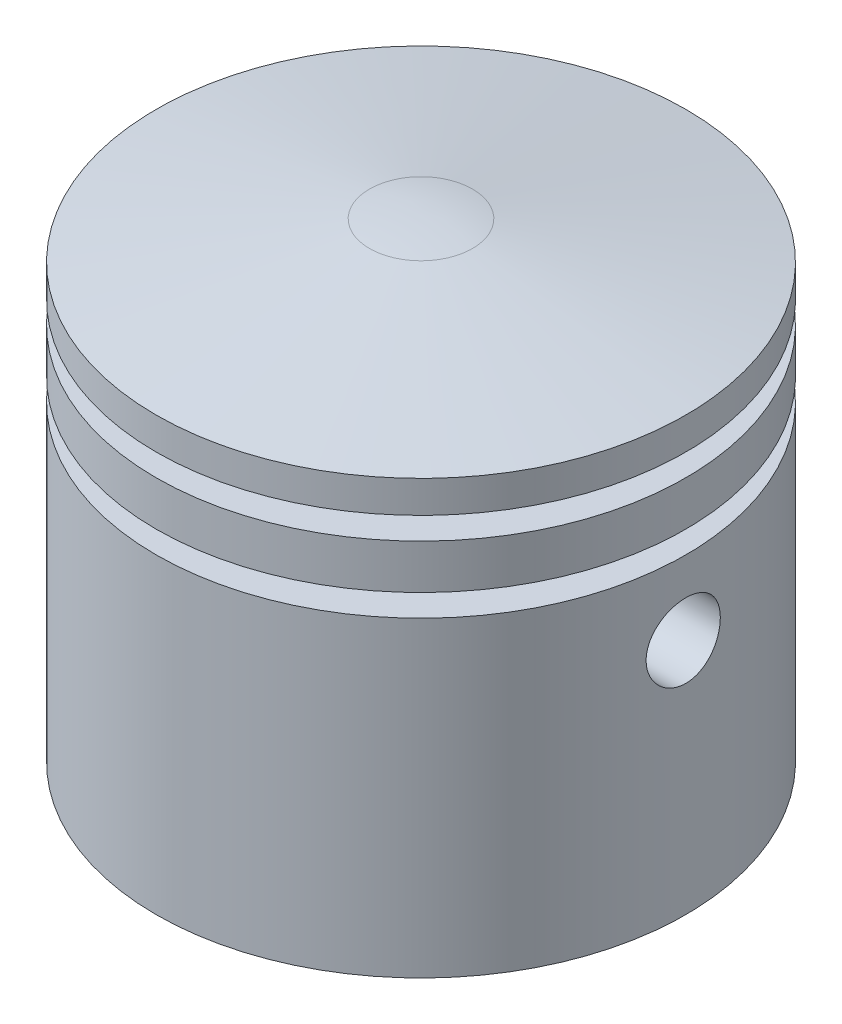
from build123d import *

# Parameters (mm, degrees)
CUT_EXTRUDE1_DEPTH      = 32.654993342
CUT_EXTRUDE1_DEPTH_BACK = 32.654993342
SKETCH3_R               = 2.5


with BuildPart() as part:
    # Sketch2 → Revolve1 (revolve)
    with BuildSketch(Plane.XY, mode=Mode.PRIVATE) as revolve1_sk:
        with BuildLine():
            Line((-17.847985654, 8.103335303), (-17.847985654, -12.896664697))
            Line((-17.847985654, -12.896664697), (-13, -12.896664697))
            Line((-13, -12.896664697), (-13, -2.896664697))
            Line((-13, -2.896664697), (-10, -2.896664697))
            Line((-10, -2.896664697), (-10, 11.103335303))
            Line((-10, 11.103335303), (0, 11.103335303))
            Line((0, 11.103335303), (0, 19.103335303))
            ThreePointArc((0, 19.103335303), (-1.743114855, 19.027229265), (-3.472963553, 18.799490363))
            Line((-3.472963553, 18.799490363), (-17.847985654, 16.264786119))
            Line((-17.847985654, 16.264786119), (-17.847985654, 14.103335303))
            Line((-17.847985654, 14.103335303), (-14.5, 14.103335303))
            Line((-14.5, 14.103335303), (-14.5, 12.603335303))
            Line((-14.5, 12.603335303), (-17.847985654, 12.603335303))
            Line((-17.847985654, 12.603335303), (-17.847985654, 9.603335303))
            Line((-17.847985654, 9.603335303), (-14.5, 9.603335303))
            Line((-14.5, 9.603335303), (-14.5, 8.103335303))
            Line((-14.5, 8.103335303), (-17.847985654, 8.103335303))
        make_face()
    revolve(revolve1_sk.sketch.rotate(Axis((0, 24.760398889, 0), (0, -1, 0)), 270), axis=Axis((0, 24.760398889, 0), (0, -1, 0)))

    # Sketch3 → Cut-Extrude1 (cut, two sides: drawn at the far end of the back side and taken through both)
    with BuildSketch(Plane(origin=(0, 0, 0), x_dir=(0, 0, -1), z_dir=(1, 0, 0)).offset(-CUT_EXTRUDE1_DEPTH_BACK)):
        with Locations((0, 3.103335303)):
            Circle(SKETCH3_R)
    extrude(amount=CUT_EXTRUDE1_DEPTH + CUT_EXTRUDE1_DEPTH_BACK, mode=Mode.SUBTRACT)


solid = part.part
